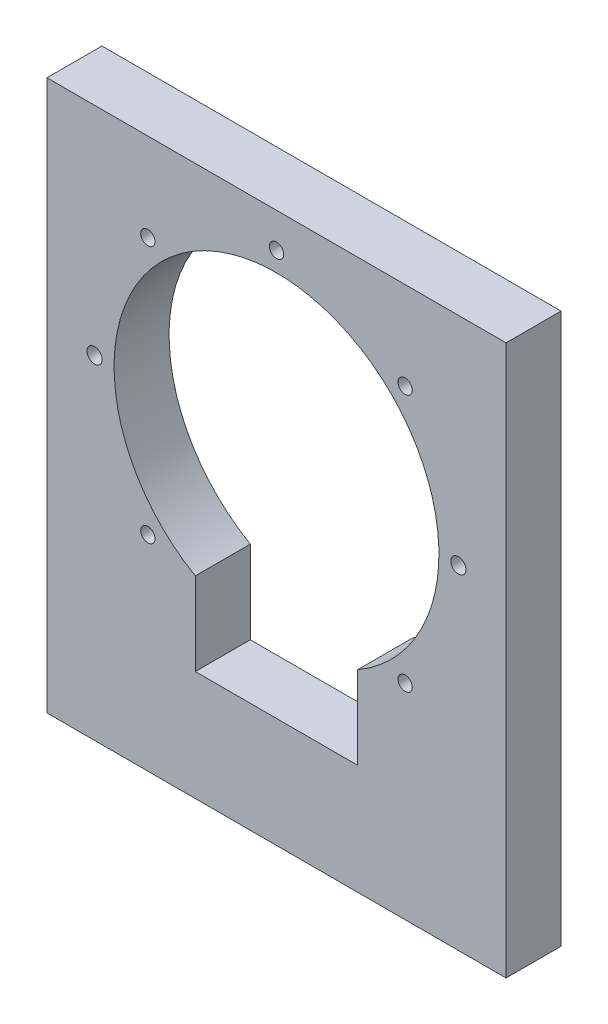
from build123d import *

# Parameters (mm, degrees)
SKETCH1_W           = 106
SKETCH1_H           = 127
SKETCH1_R           = 1.64973
SKETCH1_R_2         = 1.746
BOSS_EXTRUDE1_DEPTH = 12.7


with BuildPart() as part:
    # Sketch1 → Boss-Extrude1 (new body)
    with BuildSketch(Plane.XY):
        with Locations((53, 12.7)):
            Rectangle(SKETCH1_W, SKETCH1_H)
        with Locations((82.698486542, 55.898482492)):
            Circle(SKETCH1_R, mode=Mode.SUBTRACT)
        with Locations((95.00000245, 26.19999595)):
            Circle(SKETCH1_R_2, mode=Mode.SUBTRACT)
        with Locations((82.698486542, -3.498490592)):
            Circle(SKETCH1_R, mode=Mode.SUBTRACT)
        with Locations((23.301513458, -3.498490592)):
            Circle(SKETCH1_R, mode=Mode.SUBTRACT)
        with Locations((10.99999755, 26.1999984)):
            Circle(SKETCH1_R_2, mode=Mode.SUBTRACT)
        with Locations((23.301513458, 55.898482492)):
            Circle(SKETCH1_R, mode=Mode.SUBTRACT)
        with Locations((53, 68.1999984)):
            Circle(SKETCH1_R, mode=Mode.SUBTRACT)
        with BuildLine():
            Line((34.25, -6.275954242), (34.25, -25.4))
            Line((34.25, -25.4), (71.75, -25.4))
            Line((71.75, -25.4), (71.75, -6.275954242))
            ThreePointArc((71.75, -6.275954242), (53, 63.6999984), (34.25, -6.275954242))
        make_face(mode=Mode.SUBTRACT)
    extrude(amount=BOSS_EXTRUDE1_DEPTH)


solid = part.part
